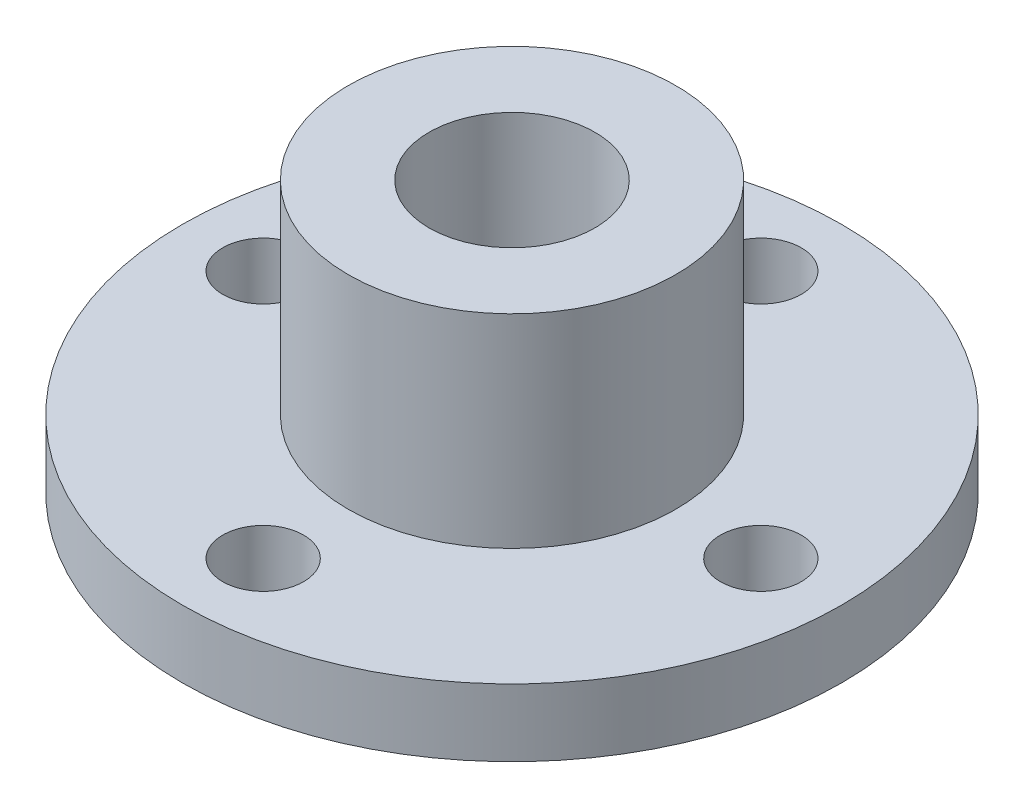
from build123d import *

# Parameters (mm, degrees)
SKETCH1_R           = 15.9
SKETCH1_R_2         = 4
BOSS_EXTRUDE1_DEPTH = 13.05
CUT_EXTRUDE1_START  = -9.8
SKETCH2_R           = 15.9
SKETCH2_R_2         = 7.9
CUT_EXTRUDE1_DEPTH  = 9.8
SKETCH3_R           = 1.95
CUT_EXTRUDE2_DEPTH  = 9.8


with BuildPart() as part:
    # Sketch1 → Boss-Extrude1 (new body)
    with BuildSketch(Plane(origin=(0, 0, 0), x_dir=(1, 0, 0), z_dir=(0, 1, 0))):
        with Locations(Location((0, 0, 0), (0, 0, 270))):
            Circle(SKETCH1_R)
        with Locations(Location((0, 0, 0), (0, 0, 270))):
            Circle(SKETCH1_R_2, mode=Mode.SUBTRACT)
    extrude(amount=BOSS_EXTRUDE1_DEPTH)

    # Sketch2 → Cut-Extrude1 (cut)
    with BuildSketch(Plane(origin=(0, 13.05, 0), x_dir=(1, 0, 0), z_dir=(0, 1, 0)).offset(CUT_EXTRUDE1_START)):
        with Locations(Location((0, 0, 0), (0, 0, 270))):
            Circle(SKETCH2_R)
        with Locations(Location((0, 0, 0), (0, 0, 270))):
            Circle(SKETCH2_R_2, mode=Mode.SUBTRACT)
    extrude(amount=CUT_EXTRUDE1_DEPTH, mode=Mode.SUBTRACT)

    # Sketch3 → Cut-Extrude2 (cut)
    with BuildSketch(Plane(origin=(0, 3.25, 0), x_dir=(1, 0, 0), z_dir=(0, 1, 0))):
        with Locations(Location((0, 12, 0), (0, 0, 270))):
            Circle(SKETCH3_R)
        with Locations(Location((12, 0, 0), (0, 0, 270))):
            Circle(SKETCH3_R)
        with Locations(Location((0, -12, 0), (0, 0, 270))):
            Circle(SKETCH3_R)
        with Locations(Location((-12, 0, 0), (0, 0, 270))):
            Circle(SKETCH3_R)
    extrude(amount=-CUT_EXTRUDE2_DEPTH, mode=Mode.SUBTRACT)


solid = part.part
